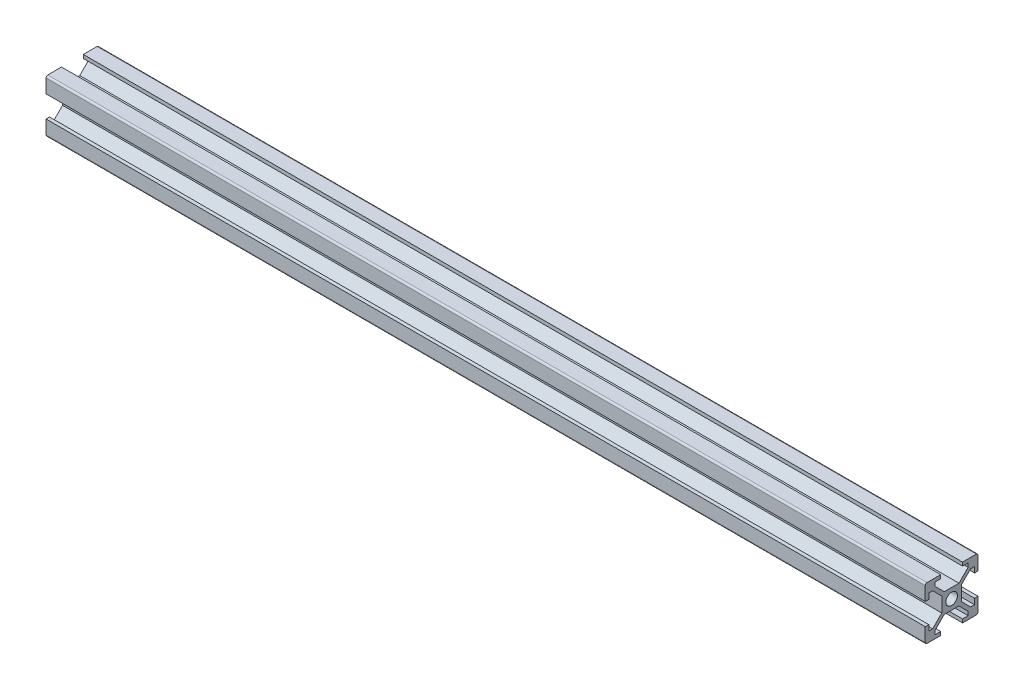
from build123d import *

# Parameters (mm, degrees)
EXTRUDE_1_DEPTH          = 250
CUT_EXTRUDE_2_DEPTH      = 251.224898841
CUT_EXTRUDE_2_DEPTH_BACK = 251.224898841
SKETCH_2_4_R             = 1.65


with BuildPart() as part:
    # 草图2 → 凸台-拉伸1 (new body)
    with BuildSketch(Plane(origin=(0, 0, 0), x_dir=(0, 0, -1), z_dir=(1, 0, 0))):
        with BuildLine():
            Line((-7, 7.5), (7, 7.5))
            ThreePointArc((7, 7.5), (7.353553391, 7.353553391), (7.5, 7))
            Line((7.5, 7), (7.5, -7))
            ThreePointArc((7.5, -7), (7.353553391, -7.353553391), (7, -7.5))
            Line((7, -7.5), (-7, -7.5))
            ThreePointArc((-7, -7.5), (-7.353553391, -7.353553391), (-7.5, -7))
            Line((-7.5, -7), (-7.5, 7))
            ThreePointArc((-7.5, 7), (-7.353553391, 7.353553391), (-7, 7.5))
        make_face()
    extrude(amount=EXTRUDE_1_DEPTH)

    # 草图2<4> → 切除-拉伸2 (cut, two sides: drawn at the far end of the back side and taken through both)
    with BuildSketch(Plane(origin=(0, 0, 0), x_dir=(0, 0, -1), z_dir=(1, 0, 0)).offset(-CUT_EXTRUDE_2_DEPTH_BACK)):
        Polygon((3.1, 7.5), (-3.1, 7.5), (-3.1, 6.5), (-4.7, 6.5), (-4.7, 5.407106781), (-2.092893219, 2.8), (2.092893219, 2.8), (4.7, 5.407106781), (4.7, 6.5), (3.1, 6.5), align=None)
        Polygon((-6.5, 3.1), (-7.5, 3.1), (-7.5, -3.1), (-6.5, -3.1), (-6.5, -4.7), (-5.407106781, -4.7), (-2.8, -2.092893219), (-2.8, 2.092893219), (-5.407106781, 4.7), (-6.5, 4.7), align=None)
        Polygon((7.5, -3.1), (7.5, 3.1), (6.5, 3.1), (6.5, 4.7), (5.407106781, 4.7), (2.8, 2.092893219), (2.8, -2.092893219), (5.407106781, -4.7), (6.5, -4.7), (6.5, -3.1), align=None)
        Polygon((-3.1, -6.5), (-3.1, -7.5), (3.1, -7.5), (3.1, -6.5), (4.7, -6.5), (4.7, -5.407106781), (2.092893219, -2.8), (-2.092893219, -2.8), (-4.7, -5.407106781), (-4.7, -6.5), align=None)
        Circle(SKETCH_2_4_R)
    extrude(amount=CUT_EXTRUDE_2_DEPTH + CUT_EXTRUDE_2_DEPTH_BACK, mode=Mode.SUBTRACT)


solid = part.part
